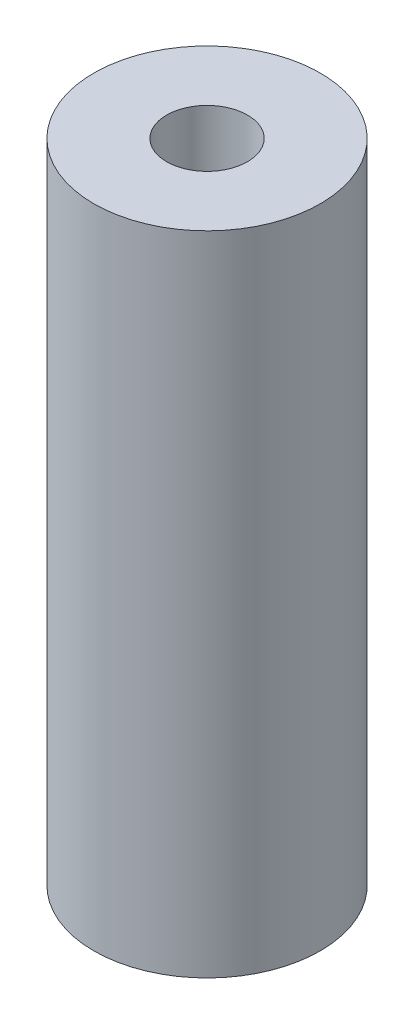
from build123d import *

# Parameters (mm, degrees)
SKETCH_1_R      = 7
SKETCH_1_R_2    = 2.5
EXTRUDE_1_DEPTH = 40


with BuildPart() as part:
    # Эскиз1 → Вытянуть1 (new body)
    with BuildSketch(Plane(origin=(0, 0, 0), x_dir=(1, 0, 0), z_dir=(0, 1, 0))):
        with Locations(Location((0, 0, 0), (0, 0, 270))):
            Circle(SKETCH_1_R)
        with Locations(Location((0, 0, 0), (0, 0, 270))):
            Circle(SKETCH_1_R_2, mode=Mode.SUBTRACT)
    extrude(amount=EXTRUDE_1_DEPTH)


solid = part.part
